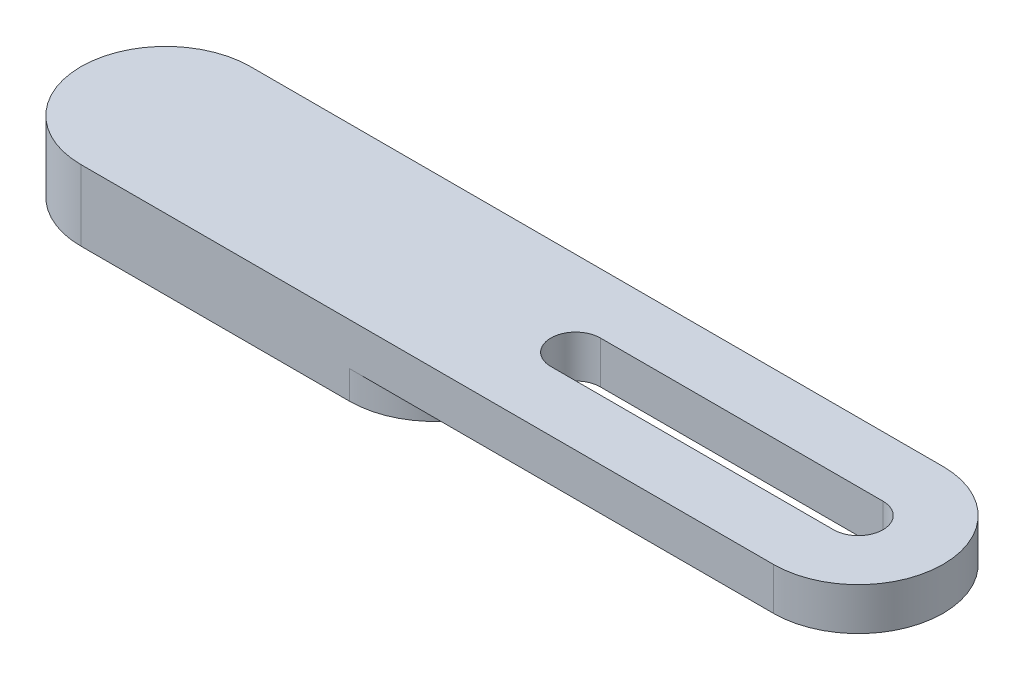
from build123d import *

# Parameters (mm, degrees)
EXTRUDE_1_DEPTH = 3
EXTRUDE_START   = 2
EXTRUDE_2_DEPTH = 2
EXTRUDE_3_DEPTH = 3


with BuildPart() as part:
    # 草图1 → 凸台-拉伸1 (new body)
    with BuildSketch(Plane(origin=(0, 0, 0), x_dir=(1, 0, 0), z_dir=(0, 1, 0))):
        with BuildLine():
            ThreePointArc((0, 6), (-6, 0), (0, -6))
            Line((0, -6), (19, -6))
            ThreePointArc((19, -6), (25, 0), (19, 6))
            Line((19, 6), (0, 6))
        make_face()
        with BuildLine():
            ThreePointArc((0.315789474, -3.987515142), (-4, 0), (0.315789474, 3.987515142))
            Line((0.315789474, 3.987515142), (19.197368421, 2.492196964))
            ThreePointArc((19.197368421, 2.492196964), (21.5, 0), (19.197368421, -2.492196964))
            Line((19.197368421, -2.492196964), (0.315789474, -3.987515142))
        make_face(mode=Mode.SUBTRACT)
    extrude(amount=-EXTRUDE_1_DEPTH)

    # 草图1<4> → 凸台-拉伸2 (add)
    with BuildSketch(Plane(origin=(0, 0, 0), x_dir=(1, 0, 0), z_dir=(0, 1, 0)).offset(EXTRUDE_START)):
        with BuildLine():
            ThreePointArc((0, 6), (-6, 0), (0, -6))
            Line((0, -6), (19, -6))
            ThreePointArc((19, -6), (25, 0), (19, 6))
            Line((19, 6), (0, 6))
        make_face()
    extrude(amount=-EXTRUDE_2_DEPTH)

    # 草图2 → 凸台-拉伸3 (add)
    with BuildSketch(Plane(origin=(0, 2, 0), x_dir=(1, 0, 0), z_dir=(0, 1, 0))):
        with BuildLine():
            Line((49, 6), (19, 6))
            ThreePointArc((19, 6), (25, 0), (19, -6))
            Line((19, -6), (49, -6))
            ThreePointArc((49, -6), (55, 0), (49, 6))
        make_face()
        with BuildLine():
            ThreePointArc((49, 1.75), (50.75, 0), (49, -1.75))
            Line((49, -1.75), (29, -1.75))
            ThreePointArc((29, -1.75), (27.25, 0), (29, 1.75))
            Line((29, 1.75), (49, 1.75))
        make_face(mode=Mode.SUBTRACT)
    extrude(amount=-EXTRUDE_3_DEPTH)


solid = part.part
